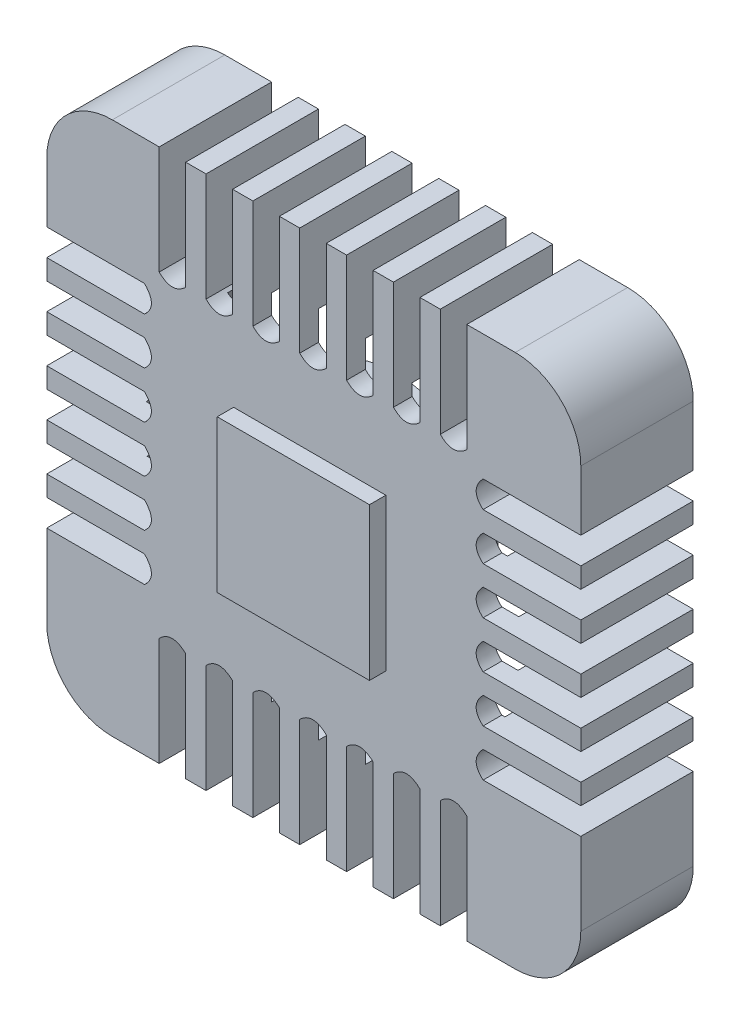
from build123d import *

# Parameters (mm, degrees)
ESQUISSE1_W             = 57
ESQUISSE1_H             = 57
BOSS_EXTRU_1_DEPTH      = 12
CONG_1_R                = 7
ENL_V_MAT_EXTRU_1_DEPTH = 12
ESQUISSE3_R             = 20
ENL_V_MAT_EXTRU_2_DEPTH = 10
ESQUISSE4_R             = 10.987625338
BOSS_EXTRU_2_DEPTH      = 7
ESQUISSE5_W             = 16.25
ESQUISSE5_H             = 16.25
BOSS_EXTRU_3_DEPTH      = 1.75


with BuildPart() as part:
    # Esquisse1 → Boss.-Extru.1 (new body)
    with BuildSketch(Plane.XY):
        with Locations((2.835459184, 3.707908163)):
            Rectangle(ESQUISSE1_W, ESQUISSE1_H)
    extrude(amount=BOSS_EXTRU_1_DEPTH)

    # Congé1
    cong_1_edges = [part.edges().sort_by_distance(p)[0] for p in [
        (-25.664540816, 32.207908163, 6),
        (31.335459184, 32.207908163, 6),
        (31.335459184, -24.792091837, 6),
        (-25.664540816, -24.792091837, 6),
    ]]
    fillet(cong_1_edges, radius=CONG_1_R)

    # Esquisse2 → Enlèv. mat.-Extru.1 (cut)
    with BuildSketch(Plane.XY.offset(12)):
        with BuildLine():
            Line((-10.832241628, 32.207908163), (-10.832241628, 20.637854033))
            add(Edge.make_bspline(
                [(-13.664540816, 20.637854033), (-12.296110252, 19.279038798), (-10.832241628, 20.637854033)],
                knots=[0, 0, 0, 1, 1, 1], degree=2))
            Line((-13.664540816, 20.637854033), (-13.664540816, 32.207908163))
            Line((-13.664540816, 32.207908163), (-10.832241628, 32.207908163))
        make_face()
        with BuildLine():
            Line((-5.832241628, 32.207908163), (-5.832241628, 20.637854033))
            add(Edge.make_bspline(
                [(-8.664540816, 20.637854033), (-7.296110252, 19.279038798), (-5.832241628, 20.637854033)],
                knots=[0, 0, 0, 1, 1, 1], degree=2))
            Line((-8.664540816, 20.637854033), (-8.664540816, 32.207908163))
            Line((-8.664540816, 32.207908163), (-5.832241628, 32.207908163))
        make_face()
        with BuildLine():
            Line((-0.832241628, 32.207908163), (-0.832241628, 20.637854033))
            add(Edge.make_bspline(
                [(-3.664540816, 20.637854033), (-2.296110252, 19.279038798), (-0.832241628, 20.637854033)],
                knots=[0, 0, 0, 1, 1, 1], degree=2))
            Line((-3.664540816, 20.637854033), (-3.664540816, 32.207908163))
            Line((-3.664540816, 32.207908163), (-0.832241628, 32.207908163))
        make_face()
        with BuildLine():
            Line((4.167758372, 32.207908163), (4.167758372, 20.637854033))
            add(Edge.make_bspline(
                [(1.335459184, 20.637854033), (2.703889748, 19.279038798), (4.167758372, 20.637854033)],
                knots=[0, 0, 0, 1, 1, 1], degree=2))
            Line((1.335459184, 20.637854033), (1.335459184, 32.207908163))
            Line((1.335459184, 32.207908163), (4.167758372, 32.207908163))
        make_face()
        with BuildLine():
            Line((9.167758372, 32.207908163), (9.167758372, 20.637854033))
            add(Edge.make_bspline(
                [(6.335459184, 20.637854033), (7.703889748, 19.279038798), (9.167758372, 20.637854033)],
                knots=[0, 0, 0, 1, 1, 1], degree=2))
            Line((6.335459184, 20.637854033), (6.335459184, 32.207908163))
            Line((6.335459184, 32.207908163), (9.167758372, 32.207908163))
        make_face()
        with BuildLine():
            Line((14.167758372, 32.207908163), (14.167758372, 20.637854033))
            add(Edge.make_bspline(
                [(11.335459184, 20.637854033), (12.703889748, 19.279038798), (14.167758372, 20.637854033)],
                knots=[0, 0, 0, 1, 1, 1], degree=2))
            Line((11.335459184, 20.637854033), (11.335459184, 32.207908163))
            Line((11.335459184, 32.207908163), (14.167758372, 32.207908163))
        make_face()
        with BuildLine():
            Line((19.167758372, 32.207908163), (19.167758372, 20.637854033))
            add(Edge.make_bspline(
                [(16.335459184, 20.637854033), (17.703889748, 19.279038798), (19.167758372, 20.637854033)],
                knots=[0, 0, 0, 1, 1, 1], degree=2))
            Line((16.335459184, 20.637854033), (16.335459184, 32.207908163))
            Line((16.335459184, 32.207908163), (19.167758372, 32.207908163))
        make_face()
        with BuildLine():
            Line((16.335459184, -24.792091837), (19.167758372, -24.792091837))
            Line((19.167758372, -24.792091837), (19.167758372, -13.222037707))
            add(Edge.make_bspline(
                [(16.335459184, -13.222037707), (17.703889748, -11.863222471), (19.167758372, -13.222037707)],
                knots=[0, 0, 0, 1, 1, 1], degree=2))
            Line((16.335459184, -13.222037707), (16.335459184, -24.792091837))
        make_face()
        with BuildLine():
            Line((11.335459184, -24.792091837), (14.167758372, -24.792091837))
            Line((14.167758372, -24.792091837), (14.167758372, -13.222037707))
            add(Edge.make_bspline(
                [(11.335459184, -13.222037707), (12.703889748, -11.863222471), (14.167758372, -13.222037707)],
                knots=[0, 0, 0, 1, 1, 1], degree=2))
            Line((11.335459184, -13.222037707), (11.335459184, -24.792091837))
        make_face()
        with BuildLine():
            Line((6.335459184, -24.792091837), (9.167758372, -24.792091837))
            Line((9.167758372, -24.792091837), (9.167758372, -13.222037707))
            add(Edge.make_bspline(
                [(6.335459184, -13.222037707), (7.703889748, -11.863222471), (9.167758372, -13.222037707)],
                knots=[0, 0, 0, 1, 1, 1], degree=2))
            Line((6.335459184, -13.222037707), (6.335459184, -24.792091837))
        make_face()
        with BuildLine():
            Line((1.335459184, -24.792091837), (4.167758372, -24.792091837))
            Line((4.167758372, -24.792091837), (4.167758372, -13.222037707))
            add(Edge.make_bspline(
                [(1.335459184, -13.222037707), (2.703889748, -11.863222471), (4.167758372, -13.222037707)],
                knots=[0, 0, 0, 1, 1, 1], degree=2))
            Line((1.335459184, -13.222037707), (1.335459184, -24.792091837))
        make_face()
        with BuildLine():
            Line((-3.664540816, -24.792091837), (-0.832241628, -24.792091837))
            Line((-0.832241628, -24.792091837), (-0.832241628, -13.222037707))
            add(Edge.make_bspline(
                [(-3.664540816, -13.222037707), (-2.296110252, -11.863222471), (-0.832241628, -13.222037707)],
                knots=[0, 0, 0, 1, 1, 1], degree=2))
            Line((-3.664540816, -13.222037707), (-3.664540816, -24.792091837))
        make_face()
        with BuildLine():
            Line((-8.664540816, -24.792091837), (-5.832241628, -24.792091837))
            Line((-5.832241628, -24.792091837), (-5.832241628, -13.222037707))
            add(Edge.make_bspline(
                [(-8.664540816, -13.222037707), (-7.296110252, -11.863222471), (-5.832241628, -13.222037707)],
                knots=[0, 0, 0, 1, 1, 1], degree=2))
            Line((-8.664540816, -13.222037707), (-8.664540816, -24.792091837))
        make_face()
        with BuildLine():
            Line((-13.664540816, -24.792091837), (-10.832241628, -24.792091837))
            Line((-10.832241628, -24.792091837), (-10.832241628, -13.222037707))
            add(Edge.make_bspline(
                [(-13.664540816, -13.222037707), (-12.296110252, -11.863222471), (-10.832241628, -13.222037707)],
                knots=[0, 0, 0, 1, 1, 1], degree=2))
            Line((-13.664540816, -13.222037707), (-13.664540816, -24.792091837))
        make_face()
        with BuildLine():
            Line((31.335459184, 15.974670539), (31.335459184, 18.806969728))
            Line((31.335459184, 18.806969728), (20.907006595, 18.800684445))
            add(Edge.make_bspline(
                [(20.907006595, 15.968385256), (19.426213418, 17.276440617), (20.907006595, 18.800684445)],
                knots=[0, 0, 0, 1, 1, 1], degree=2))
            Line((20.907006595, 15.968385256), (31.335459184, 15.974670539))
        make_face()
        with BuildLine():
            Line((31.335459184, 10.974670539), (31.335459184, 13.806969728))
            Line((31.335459184, 13.806969728), (20.907006595, 13.800684445))
            add(Edge.make_bspline(
                [(20.907006595, 10.968385256), (19.426213418, 12.276440617), (20.907006595, 13.800684445)],
                knots=[0, 0, 0, 1, 1, 1], degree=2))
            Line((20.907006595, 10.968385256), (31.335459184, 10.974670539))
        make_face()
        with BuildLine():
            Line((31.335459184, 5.974670539), (31.335459184, 8.806969728))
            Line((31.335459184, 8.806969728), (20.907006595, 8.800684445))
            add(Edge.make_bspline(
                [(20.907006595, 5.968385256), (19.426213418, 7.276440617), (20.907006595, 8.800684445)],
                knots=[0, 0, 0, 1, 1, 1], degree=2))
            Line((20.907006595, 5.968385256), (31.335459184, 5.974670539))
        make_face()
        with BuildLine():
            Line((31.335459184, 0.974670539), (31.335459184, 3.806969728))
            Line((31.335459184, 3.806969728), (20.907006595, 3.800684445))
            add(Edge.make_bspline(
                [(20.907006595, 0.968385256), (19.426213418, 2.276440617), (20.907006595, 3.800684445)],
                knots=[0, 0, 0, 1, 1, 1], degree=2))
            Line((20.907006595, 0.968385256), (31.335459184, 0.974670539))
        make_face()
        with BuildLine():
            Line((31.335459184, -4.025329461), (31.335459184, -1.193030272))
            Line((31.335459184, -1.193030272), (20.907006595, -1.199315555))
            add(Edge.make_bspline(
                [(20.907006595, -4.031614744), (19.426213418, -2.723559383), (20.907006595, -1.199315555)],
                knots=[0, 0, 0, 1, 1, 1], degree=2))
            Line((20.907006595, -4.031614744), (31.335459184, -4.025329461))
        make_face()
        with BuildLine():
            Line((31.335459184, -9.025329461), (31.335459184, -6.193030272))
            Line((31.335459184, -6.193030272), (20.907006595, -6.199315555))
            add(Edge.make_bspline(
                [(20.907006595, -9.031614744), (19.426213418, -7.723559383), (20.907006595, -6.199315555)],
                knots=[0, 0, 0, 1, 1, 1], degree=2))
            Line((20.907006595, -9.031614744), (31.335459184, -9.025329461))
        make_face()
        with BuildLine():
            Line((-25.664540816, -9.025329461), (-15.236088227, -9.031614744))
            add(Edge.make_bspline(
                [(-15.236088227, -9.031614744), (-13.755295051, -7.723559383), (-15.236088227, -6.199315555)],
                knots=[0, 0, 0, 1, 1, 1], degree=2))
            Line((-15.236088227, -6.199315555), (-25.664540816, -6.193030272))
            Line((-25.664540816, -6.193030272), (-25.664540816, -9.025329461))
        make_face()
        with BuildLine():
            Line((-25.664540816, -4.025329461), (-15.236088227, -4.031614744))
            add(Edge.make_bspline(
                [(-15.236088227, -4.031614744), (-13.755295051, -2.723559383), (-15.236088227, -1.199315555)],
                knots=[0, 0, 0, 1, 1, 1], degree=2))
            Line((-15.236088227, -1.199315555), (-25.664540816, -1.193030272))
            Line((-25.664540816, -1.193030272), (-25.664540816, -4.025329461))
        make_face()
        with BuildLine():
            Line((-25.664540816, 0.974670539), (-15.236088227, 0.968385256))
            add(Edge.make_bspline(
                [(-15.236088227, 0.968385256), (-13.755295051, 2.276440617), (-15.236088227, 3.800684445)],
                knots=[0, 0, 0, 1, 1, 1], degree=2))
            Line((-15.236088227, 3.800684445), (-25.664540816, 3.806969728))
            Line((-25.664540816, 3.806969728), (-25.664540816, 0.974670539))
        make_face()
        with BuildLine():
            Line((-25.664540816, 5.974670539), (-15.236088227, 5.968385256))
            add(Edge.make_bspline(
                [(-15.236088227, 5.968385256), (-13.755295051, 7.276440617), (-15.236088227, 8.800684445)],
                knots=[0, 0, 0, 1, 1, 1], degree=2))
            Line((-15.236088227, 8.800684445), (-25.664540816, 8.806969728))
            Line((-25.664540816, 8.806969728), (-25.664540816, 5.974670539))
        make_face()
        with BuildLine():
            Line((-25.664540816, 10.974670539), (-15.236088227, 10.968385256))
            add(Edge.make_bspline(
                [(-15.236088227, 10.968385256), (-13.755295051, 12.276440617), (-15.236088227, 13.800684445)],
                knots=[0, 0, 0, 1, 1, 1], degree=2))
            Line((-15.236088227, 13.800684445), (-25.664540816, 13.806969728))
            Line((-25.664540816, 13.806969728), (-25.664540816, 10.974670539))
        make_face()
        with BuildLine():
            Line((-25.664540816, 18.806969728), (-15.236088227, 18.800684445))
            add(Edge.make_bspline(
                [(-15.236088227, 15.968385256), (-13.755295051, 17.276440617), (-15.236088227, 18.800684445)],
                knots=[0, 0, 0, 1, 1, 1], degree=2))
            Line((-15.236088227, 15.968385256), (-25.664540816, 15.974670539))
            Line((-25.664540816, 15.974670539), (-25.664540816, 18.806969728))
        make_face()
    extrude(amount=-ENL_V_MAT_EXTRU_1_DEPTH, mode=Mode.SUBTRACT)

    # Esquisse3 → Enlèv. mat.-Extru.2 (cut)
    with BuildSketch(Plane(origin=(0, 0, 0), x_dir=(-1, 0, 0), z_dir=(0, 0, -1))):
        with Locations((-2.835459184, 3.806969728)):
            Circle(ESQUISSE3_R)
    extrude(amount=-ENL_V_MAT_EXTRU_2_DEPTH, mode=Mode.SUBTRACT)

    # Esquisse4 → Boss.-Extru.2 (add)
    with BuildSketch(Plane(origin=(0, 0, 10), x_dir=(-1, 0, 0), z_dir=(0, 0, -1))):
        with Locations((-2.54583336, 3.944874746)):
            Circle(ESQUISSE4_R)
    extrude(amount=BOSS_EXTRU_2_DEPTH)

    # Esquisse5 → Boss.-Extru.3 (add)
    with BuildSketch(Plane.XY.offset(12)):
        with Locations((2.403332578, 3.982057047)):
            Rectangle(ESQUISSE5_W, ESQUISSE5_H)
    extrude(amount=BOSS_EXTRU_3_DEPTH)


solid = part.part
